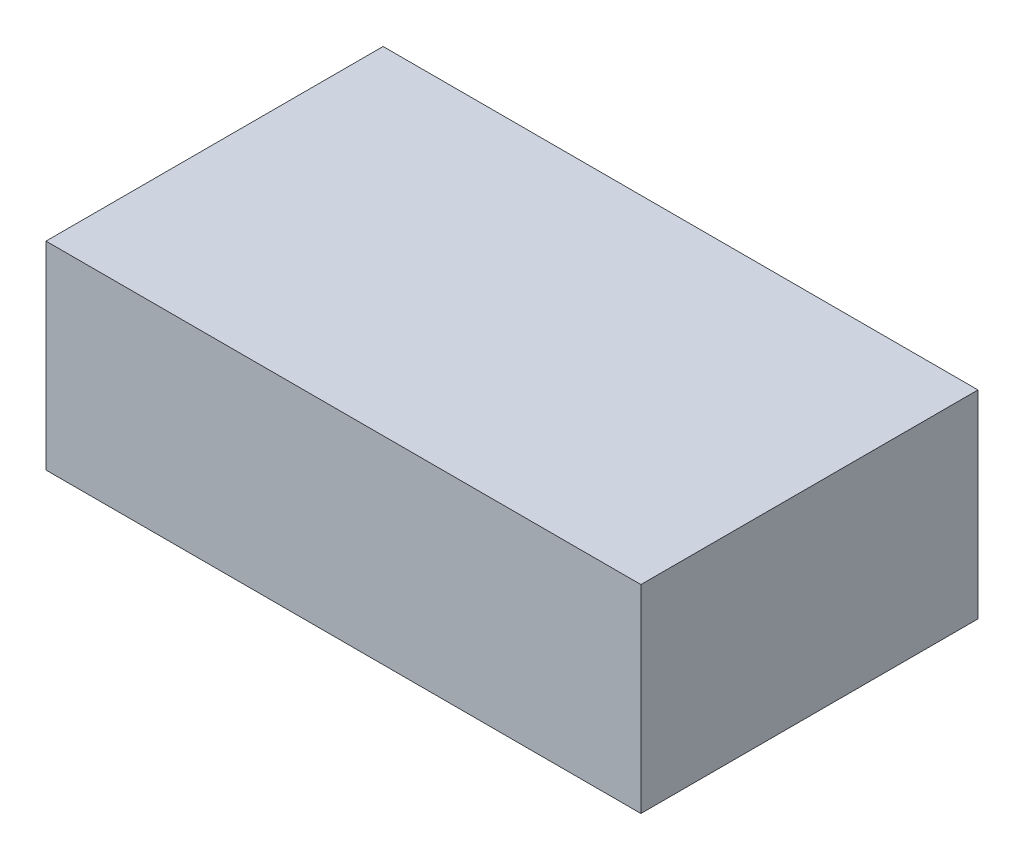
from build123d import *

# Parameters (mm, degrees)
SKETCH1_W           = 381
SKETCH1_H           = 215.9
BOSS_EXTRUDE1_DEPTH = 127


with BuildPart() as part:
    # Sketch1 → Boss-Extrude1 (new body)
    with BuildSketch(Plane(origin=(0, 0, 0), x_dir=(1, 0, 0), z_dir=(0, 1, 0))):
        with Locations((190.5, 107.95)):
            Rectangle(SKETCH1_W, SKETCH1_H)
    extrude(amount=BOSS_EXTRUDE1_DEPTH)


solid = part.part
